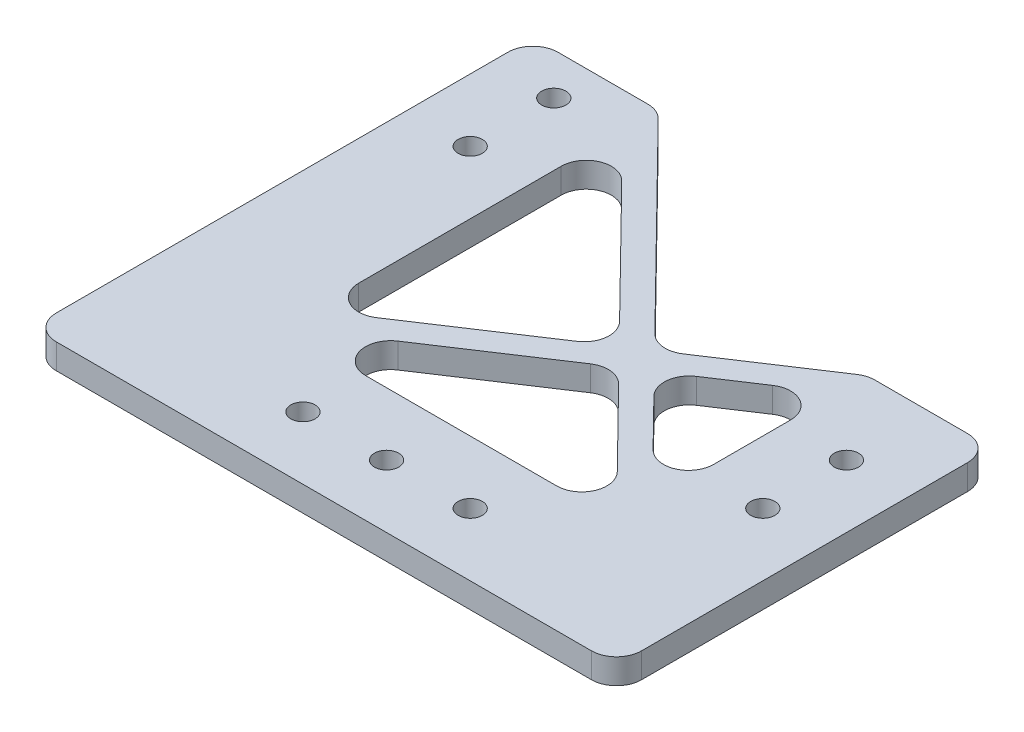
from build123d import *

# Parameters (mm, degrees)
SKETCH_1_R      = 1.45
EXTRUDE_1_DEPTH = 3
FILLET_1_R      = 3


with BuildPart() as part:
    # 草图1 → 凸台-拉伸1 (new body)
    with BuildSketch(Plane(origin=(0, 0, 0), x_dir=(1, 0, 0), z_dir=(0, 1, 0))):
        Polygon((-35, -7.5), (35, -7.5), (35, 37.5), (20, 37.5), (4.673782914, 27.382671433), (-20, 52.5), (-35, 52.5), align=None)
        with Locations(Location((-27.5, 37.5, 0), (0, 0, 270))):
            Circle(SKETCH_1_R, mode=Mode.SUBTRACT)
        with Locations(Location((-27.5, 47.5, 0), (0, 0, 270))):
            Circle(SKETCH_1_R, mode=Mode.SUBTRACT)
        with Locations(Location((27.5, 27.5, 0), (0, 0, 270))):
            Circle(SKETCH_1_R, mode=Mode.SUBTRACT)
        with Locations(Location((27.5, 17.5, 0), (0, 0, 270))):
            Circle(SKETCH_1_R, mode=Mode.SUBTRACT)
        with Locations(Location((0, 0, 0), (0, 0, 270))):
            Circle(SKETCH_1_R, mode=Mode.SUBTRACT)
        with Locations(Location((10, 0, 0), (0, 0, 270))):
            Circle(SKETCH_1_R, mode=Mode.SUBTRACT)
        with Locations(Location((-10, 0, 0), (0, 0, 270))):
            Circle(SKETCH_1_R, mode=Mode.SUBTRACT)
        Polygon((-20, 7.5), (20, 7.5), (4.264852248, 23.518008974), align=None, mode=Mode.SUBTRACT)
        Polygon((-20, 48.219055775), (2.122729676, 25.698639186), (-20, 11.094714181), align=None, mode=Mode.SUBTRACT)
        Polygon((20, 33.905285819), (6.815905486, 25.202041221), (20, 11.780944225), align=None, mode=Mode.SUBTRACT)
    extrude(amount=EXTRUDE_1_DEPTH)

    # 圆角1
    fillet_1_edges = [part.edges().sort_by_distance(p)[0] for p in [
        (-20, 1.5, -7.5),
        (20, 1.5, -7.5),
        (4.264852248, 1.5, -23.518008974),
        (2.122729676, 1.5, -25.698639186),
        (-20, 1.5, -48.219055775),
        (-20, 1.5, -11.094714181),
        (20, 1.5, -37.5),
        (35, 1.5, -37.5),
        (35, 1.5, 7.5),
        (-35, 1.5, 7.5),
        (-35, 1.5, -52.5),
        (-20, 1.5, -52.5),
        (4.673782914, 1.5, -27.382671433),
        (20, 1.5, -33.905285819),
        (6.815905486, 1.5, -25.202041221),
        (20, 1.5, -11.780944225),
    ]]
    fillet(fillet_1_edges, radius=FILLET_1_R)


solid = part.part
